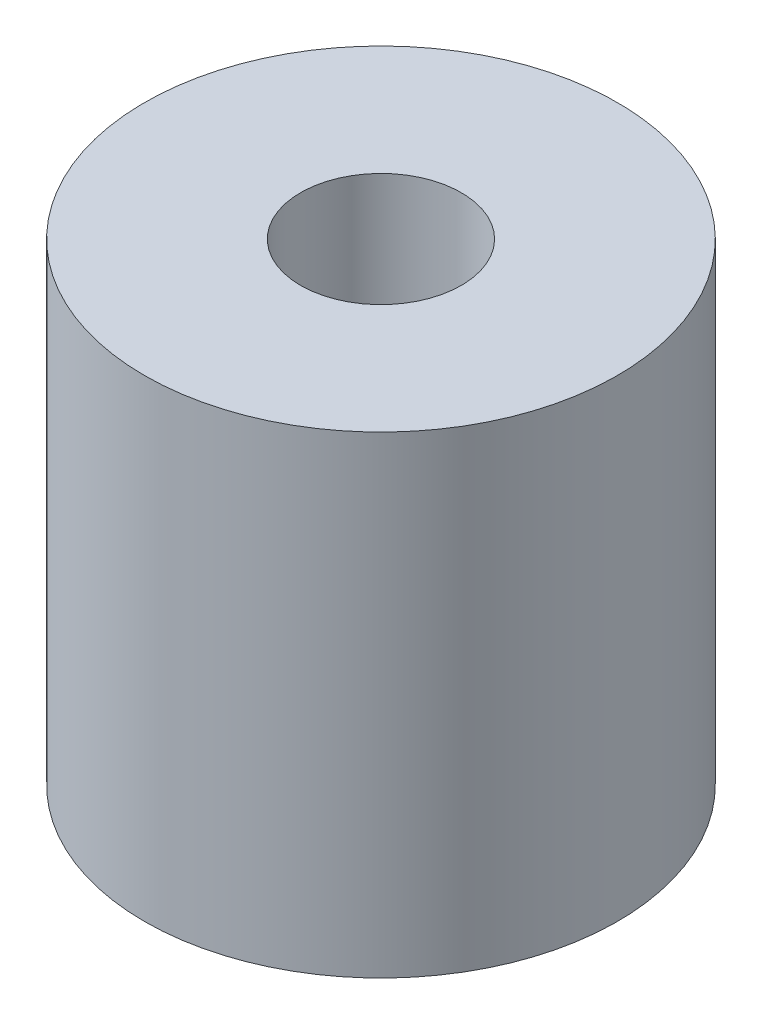
from build123d import *

# Parameters (mm, degrees)
SKETCH1_R           = 5
SKETCH1_R_2         = 1.7
BOSS_EXTRUDE1_DEPTH = 10


with BuildPart() as part:
    # Sketch1 → Boss-Extrude1 (new body)
    with BuildSketch(Plane(origin=(0, 0, 0), x_dir=(1, 0, 0), z_dir=(0, 1, 0))):
        with Locations(Location((0, 0, 0), (0, 0, 270))):
            Circle(SKETCH1_R)
        with Locations(Location((0, 0, 0), (0, 0, 270))):
            Circle(SKETCH1_R_2, mode=Mode.SUBTRACT)
    extrude(amount=BOSS_EXTRUDE1_DEPTH)


solid = part.part
